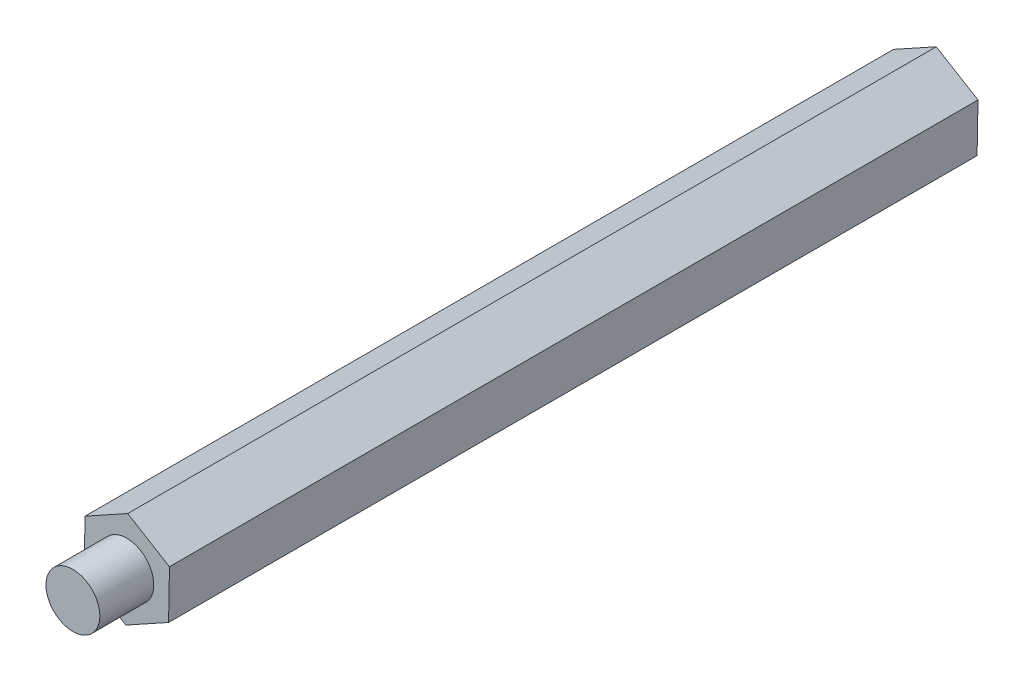
from build123d import *

# Parameters (mm, degrees)
EXTRUDE_1_DEPTH     = 45
SKETCH_2_R          = 1.5
EXTRUDE_2_DEPTH     = 3
SKETCH_3_R          = 1.5
CUT_EXTRUDE_1_DEPTH = 3


with BuildPart() as part:
    # 草图1 → 凸台-拉伸1 (new body)
    with BuildSketch(Plane.XY):
        Polygon((-2.324213399, 1.400487561), (-2.374964505, -1.312584067), (-0.050751106, -2.713071628), (2.324213399, -1.400487561), (2.374964505, 1.312584067), (0.050751106, 2.713071628), align=None)
    extrude(amount=EXTRUDE_1_DEPTH)

    # 草图2 → 凸台-拉伸2 (add)
    with BuildSketch(Plane.XY.offset(45)):
        Circle(SKETCH_2_R)
    extrude(amount=EXTRUDE_2_DEPTH)

    # 草图3 → 切除-拉伸1 (cut)
    with BuildSketch(Plane(origin=(0, 0, 0), x_dir=(-1, 0, 0), z_dir=(0, 0, -1))):
        with Locations(Location((0, 0, 0), (0, 0, 180))):
            Circle(SKETCH_3_R)
    extrude(amount=-CUT_EXTRUDE_1_DEPTH, mode=Mode.SUBTRACT)


solid = part.part
